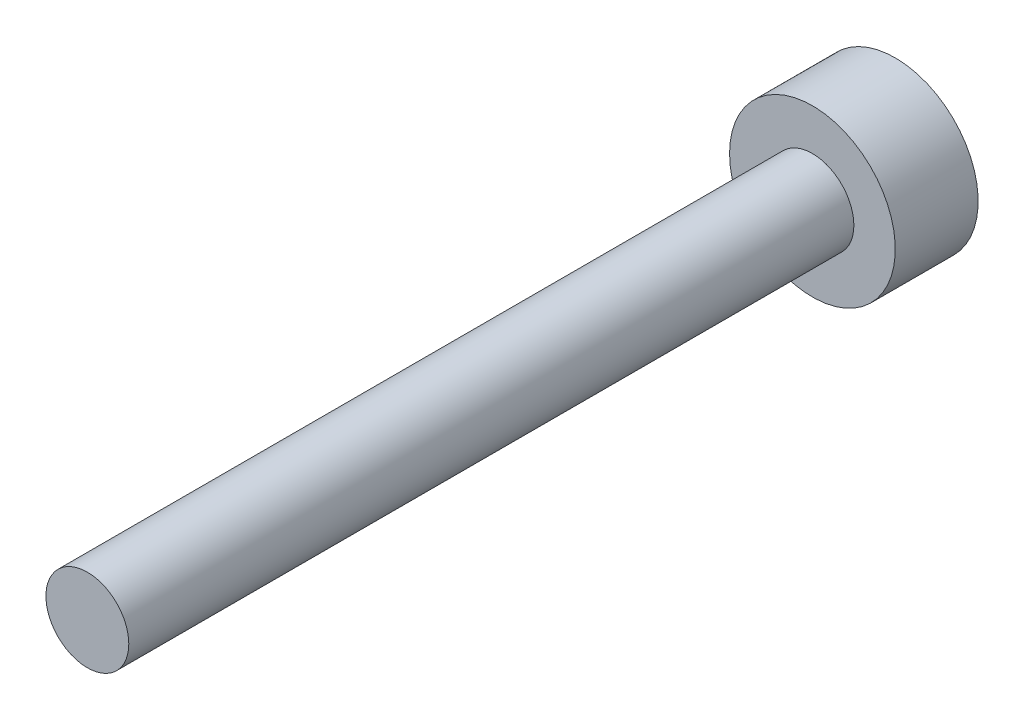
from build123d import *

# Parameters (mm, degrees)
SKETCH_1_R          = 0.4
EXTRUDE_1_DEPTH     = 7
SKETCH_2_R          = 0.8
EXTRUDE_2_DEPTH     = 0.8
CUT_EXTRUDE_1_DEPTH = 0.4


with BuildPart() as part:
    # 草图1 → 凸台-拉伸1 (new body)
    with BuildSketch(Plane.XY):
        Circle(SKETCH_1_R)
    extrude(amount=EXTRUDE_1_DEPTH)

    # 草图2 → 凸台-拉伸2 (add)
    with BuildSketch(Plane(origin=(0, 0, 0), x_dir=(-1, 0, 0), z_dir=(0, 0, -1))):
        Circle(SKETCH_2_R)
    extrude(amount=EXTRUDE_2_DEPTH)

    # 草图3 → 切除-拉伸1 (cut)
    with BuildSketch(Plane(origin=(0, 0, -0.8), x_dir=(-1, 0, 0), z_dir=(0, 0, -1))):
        Polygon((0.4, 0), (0.2, 0.346410162), (-0.2, 0.346410162), (-0.4, 0), (-0.2, -0.346410162), (0.2, -0.346410162), align=None)
    extrude(amount=-CUT_EXTRUDE_1_DEPTH, mode=Mode.SUBTRACT)


solid = part.part
